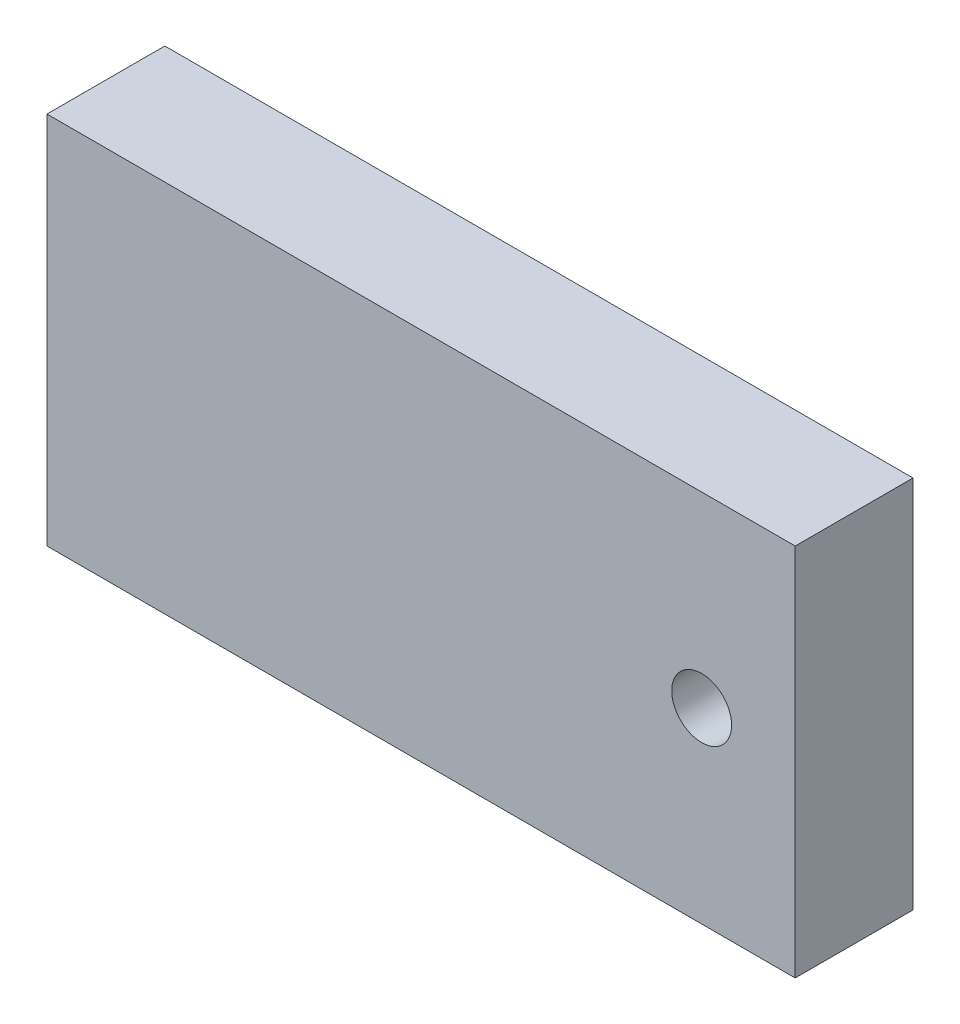
from build123d import *

# Parameters (mm, degrees)
SKETCH1_W           = 38.1
SKETCH1_H           = 19.05
SKETCH1_R           = 1.524
BOSS_EXTRUDE1_DEPTH = 6


with BuildPart() as part:
    # Sketch1 → Boss-Extrude1 (new body)
    with BuildSketch(Plane.XY):
        with Locations((19.05, 9.525)):
            Rectangle(SKETCH1_W, SKETCH1_H)
        with Locations((33.3375, 9.525)):
            Circle(SKETCH1_R, mode=Mode.SUBTRACT)
    extrude(amount=BOSS_EXTRUDE1_DEPTH)


solid = part.part
